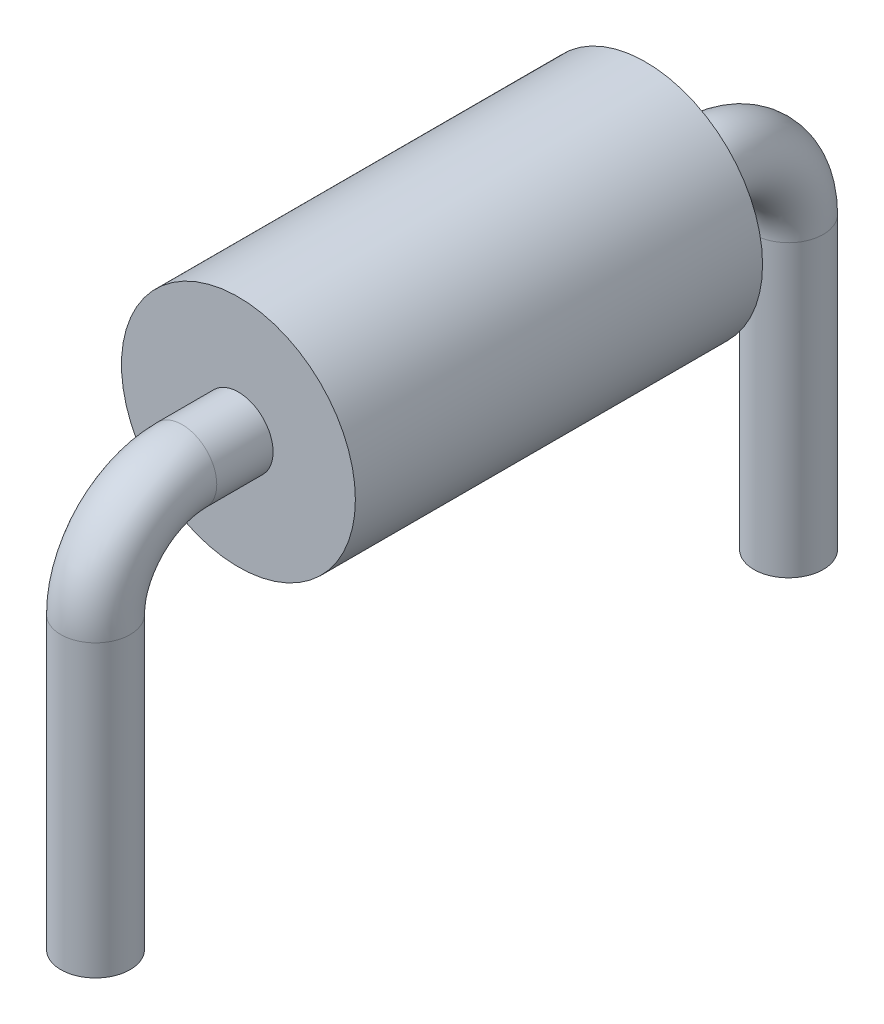
from build123d import *

# Parameters (mm, degrees)
SKETCH_1_R      = 1.35
EXTRUDE_1_DEPTH = 2.35
SKETCH_3_R      = 0.4
SKETCH_2_R      = 0.4


with BuildPart() as part:
    # Эскиз1 → Бобышка-Вытянуть1 (new, symmetric)
    with BuildSketch(Plane.XY):
        Circle(SKETCH_1_R)
    extrude(amount=EXTRUDE_1_DEPTH, both=True)

    # По траектории1: sweep along a path in Эскиз5
    with BuildLine(Plane(origin=(0, 0, 0), x_dir=(0, 0, -1), z_dir=(1, 0, 0))) as sweep_1_path:
        Line((2.35, 0), (3, 0))
        ThreePointArc((3, 0), (3.707106781, -0.292893219), (4, -1))
        Line((4, -1), (4, -4.35))
    # Эскиз3 → По траектории1 (sweep)
    with BuildSketch(Plane(origin=(0, 0, -2.35), x_dir=(-1, 0, 0), z_dir=(0, 0, -1))):
        Circle(SKETCH_3_R)
    sweep(path=sweep_1_path.line)

    # По траектории2: sweep along a path in Эскиз6
    with BuildLine(Plane(origin=(0, 0, 0), x_dir=(0, 0, -1), z_dir=(1, 0, 0))) as sweep_2_path:
        Line((-2.35, 0), (-3, 0))
        ThreePointArc((-3, 0), (-3.707106781, -0.292893219), (-4, -1))
        Line((-4, -1), (-4, -4.35))
    # Эскиз2 → По траектории2 (sweep)
    with BuildSketch(Plane.XY.offset(2.35)):
        Circle(SKETCH_2_R)
    sweep(path=sweep_2_path.line)


solid = part.part
